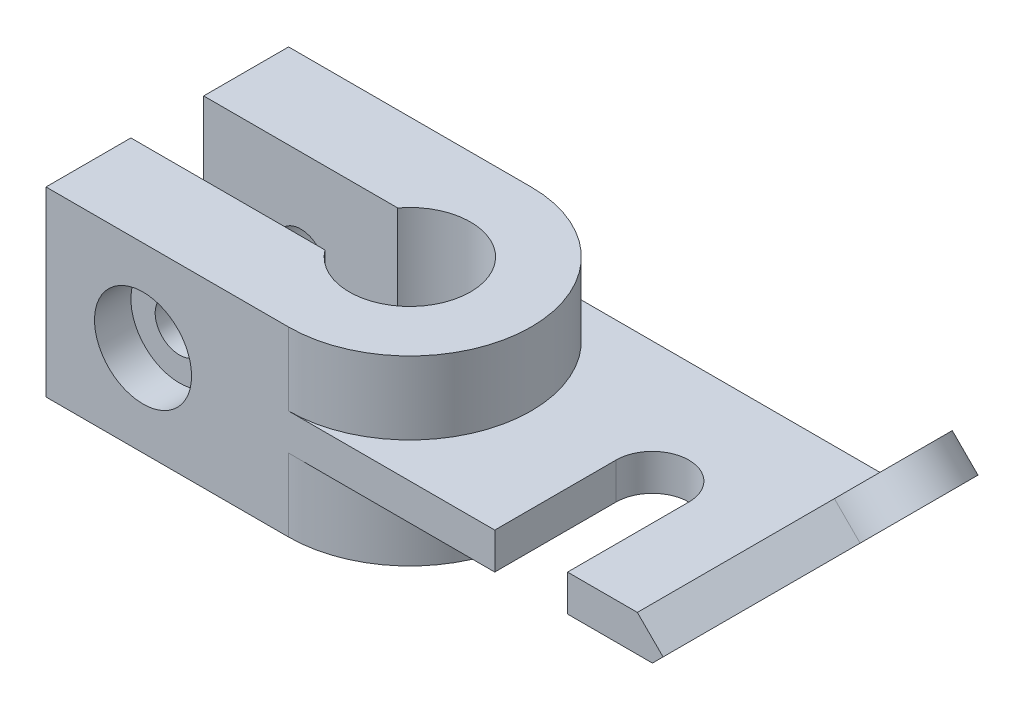
from build123d import *

# Parameters (mm, degrees)
SALIENTE_EXTRUIR1_DEPTH = 45
CROQUIS3_R              = 6
CORTAR_EXTRUIR1_DEPTH   = 97.046863561
CROQUIS3_4_R            = 12
CROQUIS3_4_R_2          = 6
CORTAR_EXTRUIR2_DEPTH   = 9
CORTAR_EXTRUIR3_START   = -9
CROQUIS4_R              = 12
CORTAR_EXTRUIR3_DEPTH   = 9
SALIENTE_EXTRUIR3_DEPTH = 45
CORTAR_EXTRUIR4_DEPTH   = 18
CORTAR_EXTRUIR5_DEPTH   = 18
SALIENTE_EXTRUIR4_DEPTH = 45
CROQUIS8_R              = 6
CORTAR_EXTRUIR7_DEPTH   = 118.153745139
CROQUIS9_R              = 12
CORTAR_EXTRUIR8_DEPTH   = 9
CORTAR_EXTRUIR9_START   = -9
CROQUIS10_R             = 12
CORTAR_EXTRUIR9_DEPTH   = 9
SALIENTE_EXTRUIR7_DEPTH = 60
CORTAR_EXTRUIR10_DEPTH  = 145.585715781
CORTAR_EXTRUIR11_DEPTH  = 145.585715781
CROQUIS21_R             = 7.5
CORTAR_EXTRUIR13_DEPTH  = 145.585715781


with BuildPart() as part:
    # Croquis2 → Saliente-Extruir1 (new body)
    with BuildSketch(Plane(origin=(0, 0, 0), x_dir=(1, 0, 0), z_dir=(0, 1, 0))):
        with BuildLine():
            Line((-12, 9), (-60, 9))
            Line((-60, 9), (-60, 30))
            Line((-60, 30), (0, 30))
            ThreePointArc((0, 30), (30, 0), (0, -30))
            Line((0, -30), (-60, -30))
            Line((-60, -30), (-60, -9))
            Line((-60, -9), (-12, -9))
            ThreePointArc((-12, -9), (15, 0), (-12, 9))
        make_face()
    extrude(amount=SALIENTE_EXTRUIR1_DEPTH)

    # Croquis3 → Cortar-Extruir1 (cut, through all)
    with BuildSketch(Plane.XY.offset(30)):
        with Locations((-36, 22.5)):
            Circle(CROQUIS3_R)
    extrude(amount=-CORTAR_EXTRUIR1_DEPTH, mode=Mode.SUBTRACT)

    # Croquis3<4> → Cortar-Extruir2 (cut)
    with BuildSketch(Plane.XY.offset(30)):
        with Locations((-36, 22.5)):
            Circle(CROQUIS3_4_R)
        with Locations((-36, 22.5)):
            Circle(CROQUIS3_4_R_2, mode=Mode.SUBTRACT)
    extrude(amount=-CORTAR_EXTRUIR2_DEPTH, mode=Mode.SUBTRACT)

    # Croquis4 → Cortar-Extruir3 (cut)
    with BuildSketch(Plane(origin=(0, 0, -30), x_dir=(-1, 0, 0), z_dir=(0, 0, -1)).offset(CORTAR_EXTRUIR3_START)):
        with Locations(Location((36, 22.5, 0), (0, 0, 180))):
            Circle(CROQUIS4_R)
    extrude(amount=CORTAR_EXTRUIR3_DEPTH, mode=Mode.SUBTRACT)

    # Croquis5 → Saliente-Extruir3 (add, through all)
    with BuildSketch(Plane(origin=(0, 45, 0), x_dir=(1, 0, 0), z_dir=(0, 1, 0))):
        with BuildLine():
            Line((51, 0), (51, -30))
            Line((51, -30), (0, -30))
            ThreePointArc((0, -30), (30, 0), (0, 30))
            Line((0, 30), (90, 30))
            Line((90, 30), (90, -30))
            Line((90, -30), (69, -30))
            Line((69, -30), (69, 0))
            ThreePointArc((69, 0), (60, 9), (51, 0))
        make_face()
    extrude(amount=-SALIENTE_EXTRUIR3_DEPTH)

    # Croquis6 → Cortar-Extruir4 (cut)
    with BuildSketch(Plane(origin=(0, 45, 0), x_dir=(1, 0, 0), z_dir=(0, 1, 0))):
        with BuildLine():
            Line((69, -30), (90, -30))
            Line((90, -30), (90, 30))
            Line((90, 30), (0, 30))
            Line((0, 30), (0, 15))
            ThreePointArc((0, 15), (15, 0), (0, -15))
            Line((0, -15), (0, -30))
            Line((0, -30), (51, -30))
            Line((51, -30), (51, 0))
            ThreePointArc((51, 0), (60, 9), (69, 0))
            Line((69, 0), (69, -30))
        make_face()
    extrude(amount=-CORTAR_EXTRUIR4_DEPTH, mode=Mode.SUBTRACT)

    # Croquis7 → Cortar-Extruir5 (cut)
    with BuildSketch(Plane.XZ):
        with BuildLine():
            Line((51, 30), (51, 0))
            ThreePointArc((51, 0), (60, -9), (69, 0))
            Line((69, 0), (69, 30))
            Line((69, 30), (90, 30))
            Line((90, 30), (90, -30))
            Line((90, -30), (0, -30))
            Line((0, -30), (0, -15))
            ThreePointArc((0, -15), (15, 0), (0, 15))
            Line((0, 15), (0, 30))
            Line((0, 30), (51, 30))
        make_face()
    extrude(amount=-CORTAR_EXTRUIR5_DEPTH, mode=Mode.SUBTRACT)

    # Croquis2<3> → Saliente-Extruir4 (add)
    with BuildSketch(Plane(origin=(0, 0, 0), x_dir=(1, 0, 0), z_dir=(0, 1, 0))):
        with BuildLine():
            Line((-12, 9), (-60, 9))
            Line((-60, 9), (-60, 30))
            Line((-60, 30), (0, 30))
            ThreePointArc((0, 30), (30, 0), (0, -30))
            Line((0, -30), (-60, -30))
            Line((-60, -30), (-60, -9))
            Line((-60, -9), (-12, -9))
            ThreePointArc((-12, -9), (15, 0), (-12, 9))
        make_face()
    extrude(amount=SALIENTE_EXTRUIR4_DEPTH)

    # Croquis8 → Cortar-Extruir7 (cut, through all)
    with BuildSketch(Plane.XY.offset(30)):
        with Locations((-36, 22.5)):
            Circle(CROQUIS8_R)
    extrude(amount=-CORTAR_EXTRUIR7_DEPTH, mode=Mode.SUBTRACT)

    # Croquis9 → Cortar-Extruir8 (cut)
    with BuildSketch(Plane.XY.offset(30)):
        with Locations((-36, 22.5)):
            Circle(CROQUIS9_R)
    extrude(amount=-CORTAR_EXTRUIR8_DEPTH, mode=Mode.SUBTRACT)

    # Croquis10 → Cortar-Extruir9 (cut)
    with BuildSketch(Plane(origin=(0, 0, -30), x_dir=(-1, 0, 0), z_dir=(0, 0, -1)).offset(CORTAR_EXTRUIR9_START)):
        with Locations(Location((36, 22.5, 0), (0, 0, 180))):
            Circle(CROQUIS10_R)
    extrude(amount=CORTAR_EXTRUIR9_DEPTH, mode=Mode.SUBTRACT)

    # Croquis16 → Saliente-Extruir7 (add, through all)
    with BuildSketch(Plane.XY.offset(30)):
        Polygon((90, 18), (132.779960262, 60.779960262), (126.415999231, 67.143921292), (83.636038969, 24.363961031), align=None)
    extrude(amount=-SALIENTE_EXTRUIR7_DEPTH)

    # Croquis18 → Cortar-Extruir10 (cut, through all)
    with BuildSketch(Plane(origin=(29.636038969, -29.636038969, 0), x_dir=(0, 0, 1), z_dir=(-0.7071067811865438, 0.7071067811865512, 0))):
        with BuildLine():
            Line((-30, 136.867532368), (-30, 80.09545443))
            Line((-30, 80.09545443), (-14.205841491, 126.68355433))
            ThreePointArc((-14.205841491, 126.68355433), (-8.739555783, 134.058519396), (0, 136.867532368))
            Line((0, 136.867532368), (-30, 136.867532368))
        make_face()
    extrude(amount=-CORTAR_EXTRUIR10_DEPTH, mode=Mode.SUBTRACT)

    # Croquis19 → Cortar-Extruir11 (cut, through all)
    with BuildSketch(Plane(origin=(29.636038969, -29.636038969, 0), x_dir=(0, 0, 1), z_dir=(-0.7071067811865438, 0.7071067811865512, 0))):
        with BuildLine():
            Line((30, 80.09545443), (14.205841491, 126.68355433))
            ThreePointArc((14.205841491, 126.68355433), (8.739555783, 134.058519396), (0, 136.867532368))
            Line((0, 136.867532368), (30, 136.867532368))
            Line((30, 136.867532368), (30, 80.09545443))
        make_face()
    extrude(amount=-CORTAR_EXTRUIR11_DEPTH, mode=Mode.SUBTRACT)

    # Croquis21 → Cortar-Extruir13 (cut, through all)
    with BuildSketch(Plane(origin=(29.636038969, -29.636038969, 0), x_dir=(0, 0, 1), z_dir=(-0.7071067811865438, 0.7071067811865512, 0))):
        with Locations(Location((0, 121.867532368, 0), (0, 0, 270))):
            Circle(CROQUIS21_R)
    extrude(amount=-CORTAR_EXTRUIR13_DEPTH, mode=Mode.SUBTRACT)


solid = part.part
